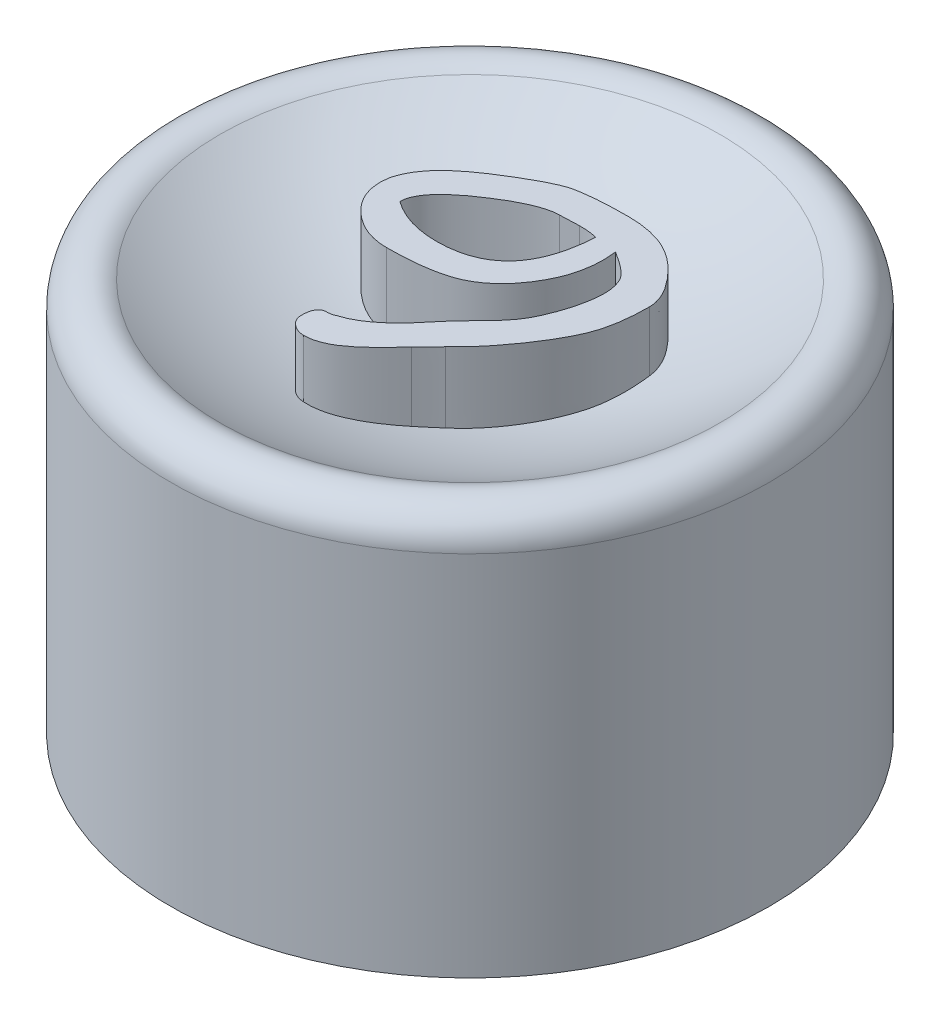
from build123d import *

# Parameters (mm, degrees)
BOSS_EXTRUDE1_REACH      = 11.257
BOSS_EXTRUDE1_END_RADIUS = 7.2532875


with BuildPart() as part:
    # Sketch1 → Revolve1 (revolve)
    with BuildSketch(Plane.XY):
        with BuildLine():
            Line((-1.5494, 0), (-1.5494, 3.048))
            Line((-1.5494, 3.048), (-0.762, 3.048))
            Line((-0.762, 3.048), (-0.762, 4.064))
            Line((-0.762, 4.064), (0, 4.064))
            Line((0, 4.064), (0, 5.08))
            ThreePointArc((0, 5.08), (-2.074697908, 5.383049508), (-3.976029965, 6.266874616))
            ThreePointArc((-3.976029965, 6.266874616), (-4.495955195, 6.288948978), (-4.7625, 5.842))
            Line((-4.7625, 5.842), (-4.7625, 0))
            Line((-4.7625, 0), (-3.4925, 0))
            Line((-3.4925, 0), (-3.4925, 4.064))
            Line((-3.4925, 4.064), (-2.0574, 4.064))
            Line((-2.0574, 4.064), (-2.0574, 0))
            Line((-2.0574, 0), (-1.5494, 0))
        make_face()
    revolve(axis=Axis((0, 0, 0), (0, -1, 0)))

    # Boss-Extrude1: up to this sphere (the profile starts inside it)
    boss_extrude1_end = Location((0, 12.3332875, 0)) * Sphere(BOSS_EXTRUDE1_END_RADIUS, mode=Mode.PRIVATE)
    # Sketch3 → Boss-Extrude1 (add, up to the surface)
    with BuildSketch(Plane(origin=(0, 6.35, 0), x_dir=(-1, 0, 0), z_dir=(0, 1, 0)), mode=Mode.PRIVATE) as boss_extrude1_sk1:
        with BuildLine():
            add(Edge.make_bspline(
                [(0.624512955, 1.683051424), (0.607518695, 1.682814154), (0.576247012, 1.682377545), (0.533851352, 1.676328102), (0.498434603, 1.669258393), (0.479595592, 1.658687903), (0.470975079, 1.653850969)],
                knots=[0, 0, 0, 0, 1.287759673, 2.369647889, 3.253969758, 4, 4, 4, 4], degree=3))
            add(Edge.make_bspline(
                [(0.470975079, 1.653850969), (0.436101703, 1.642446436), (0.363944553, 1.618849106), (0.258118038, 1.565201759), (0.150104316, 1.498348106), (0.040005366, 1.416558387), (-0.070466263, 1.318865893), (-0.184128299, 1.207355059), (-0.298543427, 1.080008407), (-0.373100531, 0.988227686), (-0.411632219, 0.940794699)],
                knots=[0, 0, 0, 0, 0.763713479, 1.580213722, 2.464611587, 3.409541979, 4.434488695, 5.535782641, 6.726473422, 8, 8, 8, 8], degree=3))
            add(Edge.make_bspline(
                [(-0.411632219, 0.940794699), (-0.428122496, 0.919948919), (-0.464772008, 0.873619334), (-0.529386826, 0.799659141), (-0.610625886, 0.715920562), (-0.669970392, 0.656254261), (-0.701752868, 0.624299446)],
                knots=[0, 0, 0, 0, 0.742262332, 1.649672215, 2.741261159, 4, 4, 4, 4], degree=3))
            add(Edge.make_bspline(
                [(-0.701752868, 0.624299446), (-0.737256898, 0.589463742), (-0.804968063, 0.52302717), (-0.896238111, 0.423178299), (-0.974139134, 0.329690177), (-1.041169142, 0.239072719), (-1.100226978, 0.142570568), (-1.154187416, 0.032883834), (-1.206852412, -0.093417213), (-1.257234744, -0.23243778), (-1.301151882, -0.377423473), (-1.332207398, -0.521397218), (-1.352146148, -0.659963726), (-1.35501122, -0.750885864), (-1.356408228, -0.795219442)],
                knots=[0, 0, 0, 0, 1.11393317, 2.124426752, 3.02848591, 3.838720282, 4.646845899, 5.558938876, 6.573828052, 7.710637071, 8.8699346, 9.963817866, 11.007158859, 12, 12, 12, 12], degree=3))
            add(Edge.make_bspline(
                [(-1.356408228, -0.795219442), (-1.355872031, -0.821342812), (-1.354811771, -0.872998349), (-1.340677657, -0.948734611), (-1.319864393, -1.021640413), (-1.296449426, -1.081613127), (-1.267230685, -1.128362643), (-1.236524579, -1.165909489), (-1.197853188, -1.206274462), (-1.150415035, -1.248912248), (-1.093155892, -1.292600874), (-1.028705343, -1.340802622), (-0.954899938, -1.390857269), (-0.901897913, -1.423403881), (-0.874129747, -1.440455301)],
                knots=[0, 0, 0, 0, 1.100379756, 2.175856625, 3.236309492, 4.298744824, 4.875655871, 5.553988434, 6.340758999, 7.231538147, 8.240817616, 9.377027747, 10.625804763, 12, 12, 12, 12], degree=3))
            add(Edge.make_bspline(
                [(-0.874129747, -1.440455301), (-0.878565692, -1.399368383), (-0.887385885, -1.317673381), (-0.888717237, -1.195441752), (-0.881781331, -1.074701938), (-0.862929204, -0.956576559), (-0.838339757, -0.839654695), (-0.801872469, -0.725508582), (-0.756654345, -0.613040818), (-0.70210555, -0.503838059), (-0.641350062, -0.399295193), (-0.576337323, -0.301082466), (-0.507563845, -0.21007557), (-0.43428914, -0.127443925), (-0.357187698, -0.052564708), (-0.277511541, 0.016040827), (-0.192274724, 0.074802272), (-0.103172704, 0.128278792), (-0.005090804, 0.174090136), (0.104042585, 0.21323148), (0.225732707, 0.245953955), (0.359102152, 0.27307897), (0.505107779, 0.293432463), (0.662894182, 0.308089703), (0.833188333, 0.317921302), (0.950726948, 0.3187026), (1.01165447, 0.319107595)],
                knots=[0, 0, 0, 0, 0.99432044, 1.977052915, 2.938895992, 3.902044954, 4.853886753, 5.812516934, 6.782404593, 7.769458704, 8.748259126, 9.691630026, 10.603215568, 11.492048732, 12.347271939, 13.189265864, 14.01964458, 14.836321741, 15.68839938, 16.620897343, 17.623913462, 18.719387043, 19.895227094, 21.170815484, 22.533458975, 24, 24, 24, 24], degree=3))
            add(Edge.make_bspline(
                [(1.01165447, 0.319107595), (1.041528833, 0.318480088), (1.100906828, 0.317232862), (1.188813871, 0.304241004), (1.274583271, 0.284683423), (1.358295753, 0.257240912), (1.439167942, 0.221215216), (1.51812121, 0.177626943), (1.594276869, 0.125347548), (1.667980288, 0.06686214), (1.736000945, 0.002815427), (1.795866864, -0.065164387), (1.846207134, -0.13659921), (1.888314317, -0.2107053), (1.918778461, -0.289127848), (1.943492401, -0.369423332), (1.95625431, -0.453827485), (1.958248211, -0.511029532), (1.959256329, -0.539950949)],
                knots=[0, 0, 0, 0, 1.013886886, 2.015191733, 3.01103115, 3.999018584, 5.001571729, 6.013438024, 7.057436786, 8.134879385, 9.205971579, 10.226119156, 11.205379279, 12.169604018, 13.112123169, 14.056871427, 15.017552079, 16, 16, 16, 16], degree=3))
            add(Edge.make_bspline(
                [(1.959256329, -0.539950949), (1.95673868, -0.579461667), (1.951565374, -0.660648939), (1.912514914, -0.782333937), (1.8524583, -0.906628262), (1.783136279, -1.009477756), (1.715985124, -1.092955031), (1.655710847, -1.156975309), (1.589342154, -1.222944754), (1.514278024, -1.289025067), (1.431757411, -1.355410654), (1.341344497, -1.422610248), (1.244035569, -1.491349371), (1.139877192, -1.558247893), (1.036025343, -1.624221633), (0.934770515, -1.683863714), (0.840620056, -1.740291899), (0.751247894, -1.789926384), (0.667460907, -1.834336471), (0.589306604, -1.873114174), (0.51672101, -1.906042509), (0.447218262, -1.935310575), (0.37320864, -1.95874017), (0.289073417, -1.978094256), (0.191873658, -1.994725418), (0.081597034, -2.008896215), (-0.042269774, -2.018732376), (-0.179212107, -2.02611908), (-0.329336971, -2.030825972), (-0.433607542, -2.031597862), (-0.487930182, -2.032)],
                knots=[0, 0, 0, 0, 1.072076243, 2.202919883, 3.442941779, 4.815202297, 5.561276349, 6.352049674, 7.202589477, 8.103002344, 9.067563951, 10.079294613, 11.163218107, 12.303673578, 13.442117297, 14.505709068, 15.496177548, 16.424172017, 17.282759056, 18.072473381, 18.79400285, 19.448250416, 20.12000474, 20.900076736, 21.792044747, 22.798294078, 23.919735532, 25.167071529, 26.524107492, 28, 28, 28, 28], degree=3))
            add(Edge.make_bspline(
                [(-0.487930182, -2.032), (-0.545160055, -2.030656892), (-0.656946606, -2.028033413), (-0.819652101, -2.004539517), (-0.973445008, -1.968547876), (-1.119006541, -1.915242113), (-1.257930629, -1.842432792), (-1.391485032, -1.747311984), (-1.522908919, -1.631627359), (-1.626518166, -1.519767911), (-1.704281192, -1.423683247), (-1.756440521, -1.352364228), (-1.800164876, -1.282129266), (-1.835961647, -1.213886123), (-1.863905539, -1.147092671), (-1.8837159, -1.081795905), (-1.896823362, -1.018043297), (-1.898270215, -0.975817998), (-1.898971519, -0.955350969)],
                knots=[0, 0, 0, 0, 1.421384088, 2.776375609, 4.076454622, 5.340325841, 6.617636122, 7.961847259, 9.404845182, 10.961627558, 11.743919308, 12.475878585, 13.155706523, 13.797819499, 14.388992624, 14.951730416, 15.491893156, 16, 16, 16, 16], degree=3))
            add(Edge.make_bspline(
                [(-1.898971519, -0.955350969), (-1.89880877, -0.911064855), (-1.898491091, -0.82462053), (-1.890264539, -0.698667537), (-1.879372243, -0.579207072), (-1.863578332, -0.466296114), (-1.842549308, -0.359860943), (-1.818827009, -0.259466126), (-1.788262786, -0.166303182), (-1.742399681, -0.048833424), (-1.671513748, 0.094204717), (-1.575670847, 0.26741883), (-1.464838697, 0.444950446), (-1.34183025, 0.622828868), (-1.212982026, 0.794679737), (-1.083210478, 0.951578615), (-0.957096194, 1.091781537), (-0.869928129, 1.174898196), (-0.827974189, 1.214902195)],
                knots=[0, 0, 0, 0, 0.852104573, 1.663266377, 2.428090107, 3.160452802, 3.856097049, 4.515608652, 5.144309507, 5.741282945, 6.941285122, 8.212549282, 9.55060541, 10.966942151, 12.373681759, 13.682771009, 14.884719021, 16, 16, 16, 16], degree=3))
            add(Edge.make_bspline(
                [(-0.827974189, 1.214902195), (-0.811865805, 1.230190844), (-0.774981135, 1.265198499), (-0.715022748, 1.327087415), (-0.641197369, 1.403068949), (-0.588880438, 1.459978599), (-0.560460344, 1.490893592)],
                knots=[0, 0, 0, 0, 0.693161186, 1.587187194, 2.689289241, 4, 4, 4, 4], degree=3))
            add(Edge.make_bspline(
                [(-0.560460344, 1.490893592), (-0.532675981, 1.521500136), (-0.478618538, 1.581048433), (-0.39744154, 1.665082915), (-0.321560006, 1.744007386), (-0.247761051, 1.81471288), (-0.177567523, 1.878303716), (-0.111302947, 1.935561235), (-0.048268634, 1.985299448), (0.028940187, 2.042069691), (0.122566877, 2.100805642), (0.236256507, 2.149252662), (0.347245577, 2.182787388), (0.421454362, 2.186244211), (0.457787777, 2.187936709)],
                knots=[0, 0, 0, 0, 1.174025574, 2.284191976, 3.318475052, 4.283499195, 5.186356305, 6.008575742, 6.770444571, 7.466123048, 8.731033799, 9.897379036, 10.970534292, 12, 12, 12, 12], degree=3))
            add(Edge.make_bspline(
                [(0.457787777, 2.187936709), (0.475468031, 2.187029285), (0.511075712, 2.185201751), (0.562912656, 2.170311035), (0.613435706, 2.147271786), (0.659856048, 2.114711034), (0.701688435, 2.076571634), (0.731275051, 2.031072514), (0.750936935, 1.981309069), (0.752670778, 1.946046081), (0.753560127, 1.927958465)],
                knots=[0, 0, 0, 0, 0.975186012, 1.964005223, 2.957377732, 4.030249205, 5.085306579, 6.061879878, 7.005870636, 8, 8, 8, 8], degree=3))
            add(Edge.make_bspline(
                [(0.753560127, 1.927958465), (0.753369315, 1.910653231), (0.753006896, 1.877784368), (0.745809529, 1.831892954), (0.737367049, 1.79160299), (0.722761475, 1.75750464), (0.704160569, 1.729494873), (0.682052746, 1.706413767), (0.654710552, 1.691085574), (0.634708274, 1.685763916), (0.624512955, 1.683051424)],
                knots=[0, 0, 0, 0, 1.375288522, 2.612167545, 3.691032624, 4.642575108, 5.543556575, 6.35636279, 7.162225114, 8, 8, 8, 8], degree=3))
        make_face()
        with BuildLine():
            add(Edge.make_bspline(
                [(1.537262658, -0.421265229), (1.506771633, -0.400734181), (1.446196243, -0.359945908), (1.350458001, -0.306557258), (1.250422292, -0.26301969), (1.147354427, -0.225012117), (1.039634629, -0.198996243), (0.929149163, -0.177482948), (0.814756003, -0.165106664), (0.737261247, -0.16382199), (0.697985067, -0.163170886)],
                knots=[0, 0, 0, 0, 0.98805729, 1.962936747, 2.941755422, 3.919007606, 4.911992894, 5.916962059, 6.944266989, 8, 8, 8, 8], degree=3))
            add(Edge.make_bspline(
                [(0.697985067, -0.163170886), (0.652084199, -0.163838106), (0.562495231, -0.165140379), (0.432486352, -0.182129652), (0.310047535, -0.206476954), (0.196699874, -0.243850005), (0.091203173, -0.289766337), (-0.006048818, -0.346807685), (-0.094501157, -0.414961564), (-0.175434951, -0.492696643), (-0.247297152, -0.58107171), (-0.310894861, -0.679891897), (-0.36509963, -0.789456142), (-0.411193634, -0.909087355), (-0.449904348, -1.038459558), (-0.479642409, -1.178340333), (-0.501523896, -1.328440892), (-0.508716746, -1.432223449), (-0.512420886, -1.485668908)],
                knots=[0, 0, 0, 0, 1.085309643, 2.118299137, 3.097442283, 4.034856315, 4.936281496, 5.815450423, 6.695121445, 7.572562227, 8.464848455, 9.383948836, 10.347465598, 11.351847168, 12.414259089, 13.539199105, 14.732748182, 16, 16, 16, 16], degree=3))
            add(Edge.make_bspline(
                [(-0.512420886, -1.485668908), (-0.493323995, -1.490329434), (-0.452304362, -1.500340125), (-0.385565921, -1.510473289), (-0.309676073, -1.515766968), (-0.256218787, -1.516412122), (-0.227951938, -1.516753263)],
                knots=[0, 0, 0, 0, 0.821661553, 1.764908005, 2.818140375, 4, 4, 4, 4], degree=3))
            Line((-0.227951938, -1.516753263), (0.084775514, -1.504507911))
            add(Edge.make_bspline(
                [(0.084775514, -1.504507911), (0.112189645, -1.503427593), (0.170430127, -1.50113249), (0.260779319, -1.480218432), (0.359414237, -1.450030913), (0.465963597, -1.406950073), (0.580422837, -1.351932945), (0.7034761, -1.286057145), (0.83294739, -1.20591573), (0.967622276, -1.118475057), (1.097957467, -1.026568087), (1.21444624, -0.933556257), (1.312432224, -0.842283799), (1.393901321, -0.754687648), (1.457412753, -0.668728923), (1.501928016, -0.584237191), (1.53229177, -0.502429938), (1.535652443, -0.447556829), (1.537262658, -0.421265229)],
                knots=[0, 0, 0, 0, 0.689642863, 1.465125118, 2.325624353, 3.287496711, 4.355769763, 5.523393416, 6.80099338, 8.189430384, 9.567468658, 10.81610444, 11.940758363, 12.937121899, 13.826111395, 14.622049616, 15.339776428, 16, 16, 16, 16], degree=3))
        make_face(mode=Mode.SUBTRACT)
    boss_extrude1_tool1 = extrude(boss_extrude1_sk1.sketch, amount=-BOSS_EXTRUDE1_REACH, mode=Mode.PRIVATE) & boss_extrude1_end
    add(boss_extrude1_tool1.solids().sort_by_distance((0.149381, 6.35, -0.359394))[0])


solid = part.part
